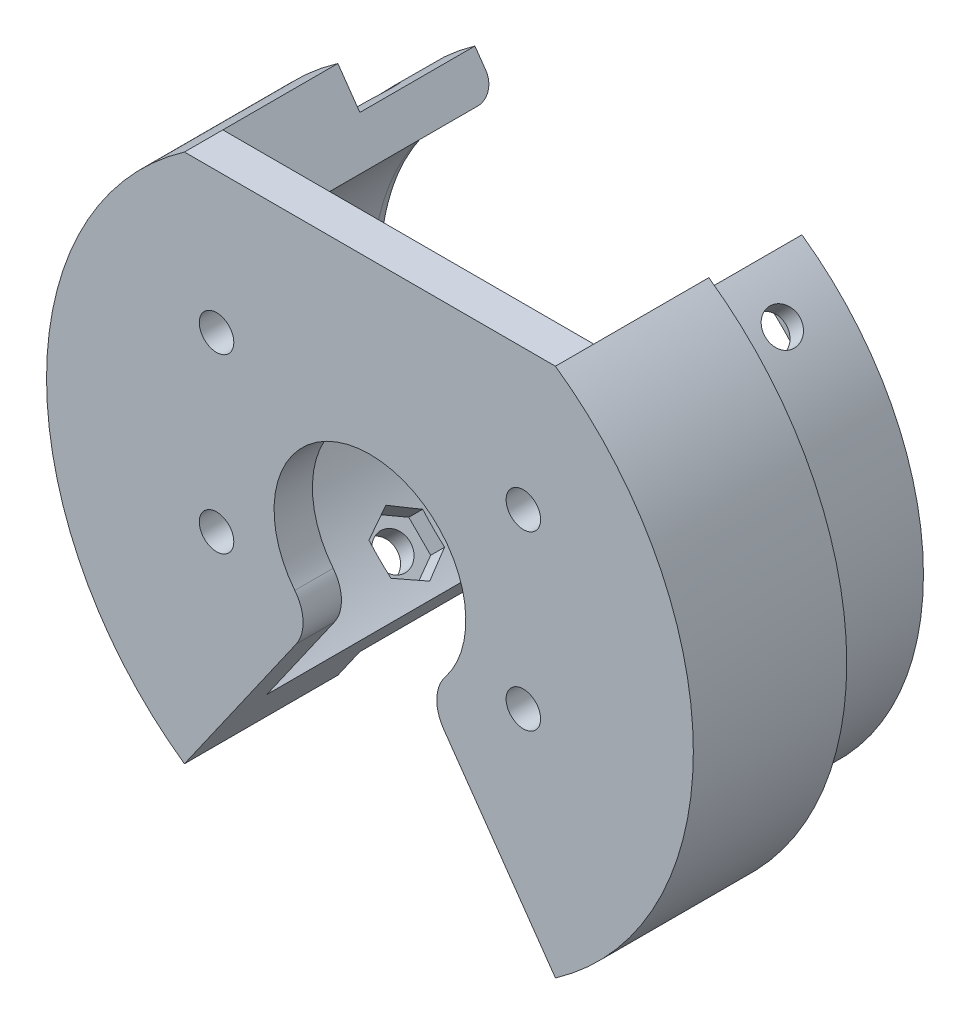
from build123d import *
from build123d.topology import SkipClean

# Parameters (mm, degrees)
SKETCH1_R               = 37.16223967
SKETCH1_R_2             = 32.16223967
BOSS_EXTRUDE1_DEPTH     = 7.5
CUT_EXTRUDE1_DEPTH      = 54.087796287
BOSS_EXTRUDE2_DEPTH     = 15
BOSS_EXTRUDE3_DEPTH     = 5
CUT_EXTRUDE2_START      = -10
SKETCH8_R               = 2.25
CUT_EXTRUDE2_DEPTH      = 101.828192003
CUT_EXTRUDE3_START      = -10
CUT_EXTRUDE3_DEPTH      = 12.5
MIRROR3_START           = -10
MIRROR3_COPY_1_SKETCH_R = 2.25
MIRROR3_COPY_1_DEPTH    = 101.828192003
MIRROR3_COPY_2_DEPTH    = 12.5
MIRROR3_COPY_3_SKETCH_R = 2.25
MIRROR3_COPY_3_DEPTH    = 101.828192003
MIRROR3_COPY_4_DEPTH    = 12.5
CUT_EXTRUDE4_DEPTH      = 65.772513488
CUT_EXTRUDE4_DEPTH_BACK = 65.772513488
FILLET1_R               = 5
FILLET2_R               = 2.5
SKETCH11_R              = 2.25
EXAMPLE_MOUNT_DEPTH     = 65.772513488


with BuildPart() as part:
    # Sketch1 → Boss-Extrude1 (new, symmetric)
    with BuildSketch(Plane.XY):
        Circle(SKETCH1_R)
        Circle(SKETCH1_R_2, mode=Mode.SUBTRACT)
    extrude(amount=BOSS_EXTRUDE1_DEPTH, both=True)

    # Sketch2 → Cut-Extrude1 (cut, symmetric)
    with BuildSketch(Plane.XY):
        with BuildLine():
            Line((21.315384997, 30.441524596), (18.447502815, 26.345764375))
            ThreePointArc((18.447502815, 26.345764375), (0, 32.16223967), (-18.447502815, 26.345764375))
            Line((-18.447502815, 26.345764375), (-21.315384997, 30.441524596))
            ThreePointArc((-21.315384997, 30.441524596), (0, 37.16223967), (21.315384997, 30.441524596))
        make_face()
    cut_extrude1 = extrude(amount=CUT_EXTRUDE1_DEPTH, both=True, mode=Mode.SUBTRACT)

    # Mirror1: Cut-Extrude1 across plane
    add(cut_extrude1.mirror(Plane.ZX), mode=Mode.SUBTRACT)

    # Sketch3 → Boss-Extrude2 (add)
    with SkipClean():  # the faces are left unmerged after this step: merging them gives an invalid solid
        with BuildSketch(Plane.XY.offset(7.5)):
            with BuildLine():
                Line((-18.447502815, 26.345764375), (-24.183267178, 34.537284817))
                ThreePointArc((-24.183267178, 34.537284817), (-42.16223967, 0), (-24.183267178, -34.537284817))
                Line((-24.183267178, -34.537284817), (-18.447502815, -26.345764375))
                ThreePointArc((-18.447502815, -26.345764375), (-32.16223967, 0), (-18.447502815, 26.345764375))
            make_face()
            with BuildLine():
                Line((18.447502815, -26.345764375), (24.183267178, -34.537284817))
                ThreePointArc((24.183267178, -34.537284817), (42.16223967, 0), (24.183267178, 34.537284817))
                Line((24.183267178, 34.537284817), (18.447502815, 26.345764375))
                ThreePointArc((18.447502815, 26.345764375), (32.16223967, 0), (18.447502815, -26.345764375))
            make_face()
        extrude(amount=BOSS_EXTRUDE2_DEPTH)

    # Sketch4 → Boss-Extrude3 (add)
    with SkipClean():  # the faces are left unmerged after this step: merging them gives an invalid solid
        with BuildSketch(Plane.XY.offset(22.5)):
            with BuildLine():
                Line((24.183267178, 34.537284817), (-24.183267178, 34.537284817))
                ThreePointArc((-24.183267178, 34.537284817), (-42.16223967, 0), (-24.183267178, -34.537284817))
                Line((-24.183267178, -34.537284817), (24.183267178, -34.537284817))
                ThreePointArc((24.183267178, -34.537284817), (42.16223967, 0), (24.183267178, 34.537284817))
            make_face()
        extrude(amount=BOSS_EXTRUDE3_DEPTH)

    # Sketch8 → Cut-Extrude2 (cut)
    with SkipClean():  # the faces are left unmerged after this step: merging them gives an invalid solid
        with BuildSketch(Plane(origin=(22.742137769, 22.742137769, 0), x_dir=(0.7071067811865486, -0.7071067811865465, 0), z_dir=(0.7071067811865465, 0.7071067811865486, 0)).offset(CUT_EXTRUDE2_START)):
            Circle(SKETCH8_R)
        cut_extrude2 = extrude(amount=CUT_EXTRUDE2_DEPTH, mode=Mode.SUBTRACT)

    # Sketch9 → Cut-Extrude3 (cut)
    with SkipClean():  # the faces are left unmerged after this step: merging them gives an invalid solid
        with BuildSketch(Plane(origin=(22.742137769, 22.742137769, 0), x_dir=(0.7071067811865486, -0.7071067811865465, 0), z_dir=(0.7071067811865465, 0.7071067811865486, 0)).offset(CUT_EXTRUDE3_START)):
            Polygon((2.020725942, -3.5), (4.041451884, 0), (2.020725942, 3.5), (-2.020725942, 3.5), (-4.041451884, 0), (-2.020725942, -3.5), align=None)
        cut_extrude3 = extrude(amount=CUT_EXTRUDE3_DEPTH, mode=Mode.SUBTRACT)

    # Mirror2: Cut-Extrude2, Cut-Extrude3 across plane
    with SkipClean():  # the faces are left unmerged after this step: merging them gives an invalid solid
        add(cut_extrude2.mirror(Plane.ZX), mode=Mode.SUBTRACT)
        add(cut_extrude3.mirror(Plane.ZX), mode=Mode.SUBTRACT)

    # Mirror3 copy 1 sketch → Mirror3 copy 1 (cut)
    with SkipClean():  # the faces are left unmerged after this step: merging them gives an invalid solid
        with BuildSketch(Plane(origin=(-22.742137769, -22.742137769, 0), x_dir=(-0.7071067811865486, 0.7071067811865465, 0), z_dir=(-0.7071067811865465, -0.7071067811865486, 0)).offset(MIRROR3_START)):
            Circle(MIRROR3_COPY_1_SKETCH_R)
        extrude(amount=MIRROR3_COPY_1_DEPTH, mode=Mode.SUBTRACT)

    # Mirror3 copy 2 sketch → Mirror3 copy 2 (cut)
    with SkipClean():  # the faces are left unmerged after this step: merging them gives an invalid solid
        with BuildSketch(Plane(origin=(-22.742137769, -22.742137769, 0), x_dir=(-0.7071067811865486, 0.7071067811865465, 0), z_dir=(-0.7071067811865465, -0.7071067811865486, 0)).offset(MIRROR3_START)):
            Polygon((2.020725942, -3.5), (4.041451884, 0), (2.020725942, 3.5), (-2.020725942, 3.5), (-4.041451884, 0), (-2.020725942, -3.5), align=None)
        extrude(amount=MIRROR3_COPY_2_DEPTH, mode=Mode.SUBTRACT)

    # Mirror3 copy 3 sketch → Mirror3 copy 3 (cut)
    with SkipClean():  # the faces are left unmerged after this step: merging them gives an invalid solid
        with BuildSketch(Plane(origin=(-22.742137769, 22.742137769, 0), x_dir=(-0.7071067811865486, -0.7071067811865465, 0), z_dir=(-0.7071067811865465, 0.7071067811865486, 0)).offset(MIRROR3_START)):
            Circle(MIRROR3_COPY_3_SKETCH_R)
        extrude(amount=MIRROR3_COPY_3_DEPTH, mode=Mode.SUBTRACT)

    # Mirror3 copy 4 sketch → Mirror3 copy 4 (cut)
    with SkipClean():  # the faces are left unmerged after this step: merging them gives an invalid solid
        with BuildSketch(Plane(origin=(-22.742137769, 22.742137769, 0), x_dir=(-0.7071067811865486, -0.7071067811865465, 0), z_dir=(-0.7071067811865465, 0.7071067811865486, 0)).offset(MIRROR3_START)):
            Polygon((2.020725942, 3.5), (4.041451884, 0), (2.020725942, -3.5), (-2.020725942, -3.5), (-4.041451884, 0), (-2.020725942, 3.5), align=None)
        extrude(amount=MIRROR3_COPY_4_DEPTH, mode=Mode.SUBTRACT)

    # Sketch10 → Cut-Extrude4 (cut, two sides: drawn at the far end of the back side and taken through both)
    with SkipClean():  # the faces are left unmerged after this step: merging them gives an invalid solid
        with BuildSketch(Plane.XY.offset(27.5).offset(-CUT_EXTRUDE4_DEPTH_BACK)):
            with BuildLine():
                Line((-24.183267178, -34.537284817), (-7.169705454, -10.239400554))
                ThreePointArc((-7.169705454, -10.239400554), (0, 12.5), (7.169705454, -10.239400554))
                Line((7.169705454, -10.239400554), (24.183267178, -34.537284817))
                Line((24.183267178, -34.537284817), (-24.183267178, -34.537284817))
            make_face()
        extrude(amount=CUT_EXTRUDE4_DEPTH + CUT_EXTRUDE4_DEPTH_BACK, mode=Mode.SUBTRACT)

    # Fillet1
    fillet1_edges = [part.edges().sort_by_distance(p)[0] for p in [
        (7.169705454, -10.239400554, 25),
        (-7.169705454, -10.239400554, 25),
    ]]
    fillet(fillet1_edges, radius=FILLET1_R)

    # Fillet2
    fillet2_edges = [part.edges().sort_by_distance(p)[0] for p in [
        (32.16223967, 0, -7.5),
        (-32.16223967, 0, -7.5),
    ]]
    fillet(fillet2_edges, radius=FILLET2_R)

    # Sketch11 → example_mount (cut, through all)
    with SkipClean():  # the faces are left unmerged after this step: merging them gives an invalid solid
        with BuildSketch(Plane.XY.offset(27.5)):
            with Locations((-20, -6.25)):
                Circle(SKETCH11_R)
            with Locations((-20, 16.25)):
                Circle(SKETCH11_R)
            with Locations((20, 16.25)):
                Circle(SKETCH11_R)
            with Locations((20, -6.25)):
                Circle(SKETCH11_R)
        extrude(amount=-EXAMPLE_MOUNT_DEPTH, mode=Mode.SUBTRACT)


solid = part.part
